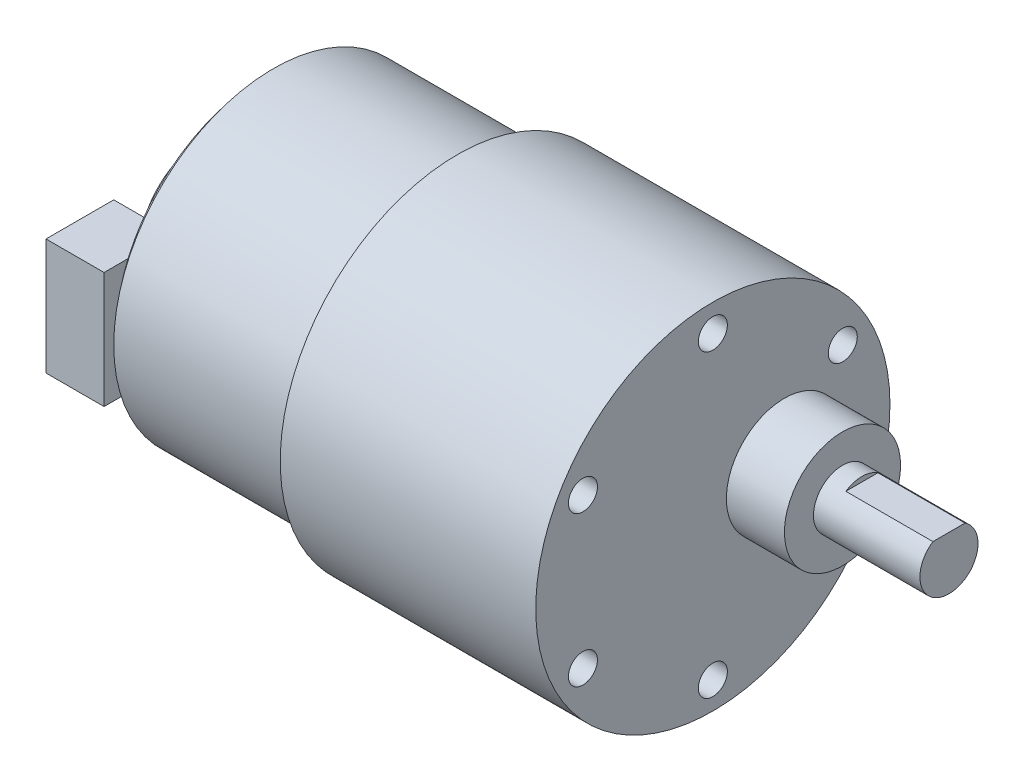
from build123d import *

# Parameters (mm, degrees)
SKETCH_1_R          = 18.3
EXTRUDE_1_DEPTH     = 26.4
SKETCH_4_R          = 16.5
EXTRUDE_2_DEPTH     = 19
SKETCH_5_R          = 15.25
EXTRUDE_3_DEPTH     = 1
SKETCH_6_R          = 6.9
EXTRUDE_4_DEPTH     = 6
SKETCH_7_W          = 7
SKETCH_7_H          = 12
EXTRUDE_5_DEPTH     = 6
SKETCH_3_R          = 1.5
CUT_EXTRUDE_7_DEPTH = 4
SKETCH_18_R         = 6
EXTRUDE_7_DEPTH     = 6
SKETCH_19_R         = 3
EXTRUDE_9_DEPTH     = 2
EXTRUDE_10_DEPTH    = 9


with BuildPart() as part:
    # 草图1 → 凸台-拉伸1 (new body)
    with BuildSketch(Plane(origin=(0, 0, 0), x_dir=(0, 0, -1), z_dir=(1, 0, 0))):
        Circle(SKETCH_1_R)
    extrude(amount=EXTRUDE_1_DEPTH)

    # 草图4 → 凸台-拉伸2 (add)
    with BuildSketch(Plane.ZY):
        Circle(SKETCH_4_R)
    extrude(amount=EXTRUDE_2_DEPTH)

    # 草图5 → 凸台-拉伸3 (add)
    with BuildSketch(Plane.ZY.offset(19)):
        Circle(SKETCH_5_R)
    extrude(amount=EXTRUDE_3_DEPTH)

    # 草图6 → 凸台-拉伸4 (add)
    with BuildSketch(Plane.ZY.offset(20)):
        Circle(SKETCH_6_R)
    extrude(amount=EXTRUDE_4_DEPTH)

    # 草图7 → 凸台-拉伸5 (add)
    with BuildSketch(Plane.ZY.offset(20)):
        with Locations((13, 0)):
            Rectangle(SKETCH_7_W, SKETCH_7_H)
    extrude(amount=EXTRUDE_5_DEPTH)

    # 草图3 → 切除-拉伸7 (cut)
    with BuildSketch(Plane(origin=(26.4, 0, 0), x_dir=(0, 0, -1), z_dir=(1, 0, 0))):
        with Locations((-13.423393759, 7.75)):
            Circle(SKETCH_3_R)
        with Locations((-13.423393759, -7.75)):
            Circle(SKETCH_3_R)
        with Locations((0, -15.5)):
            Circle(SKETCH_3_R)
        with Locations((13.423393759, -7.75)):
            Circle(SKETCH_3_R)
        with Locations((13.423393759, 7.75)):
            Circle(SKETCH_3_R)
        with Locations((0, 15.5)):
            Circle(SKETCH_3_R)
    extrude(amount=-CUT_EXTRUDE_7_DEPTH, mode=Mode.SUBTRACT)

    # 草图18 → 凸台-拉伸7 (add)
    with BuildSketch(Plane(origin=(26.4, 0, 0), x_dir=(0, 0, -1), z_dir=(1, 0, 0))):
        with Locations((7.396149949, 0)):
            Circle(SKETCH_18_R)
    extrude(amount=EXTRUDE_7_DEPTH)

    # 草图19 → 凸台-拉伸9 (add)
    with BuildSketch(Plane(origin=(32.4, 0, 0), x_dir=(0, 0, -1), z_dir=(1, 0, 0))):
        with Locations((7.396149949, 0)):
            Circle(SKETCH_19_R)
    extrude(amount=EXTRUDE_9_DEPTH)

    # 草图23 → 凸台-拉伸10 (add)
    with BuildSketch(Plane(origin=(34.4, 0, 0), x_dir=(0, 0, -1), z_dir=(1, 0, 0))):
        with BuildLine():
            Line((5.737938338, 2.500066849), (9.054361561, 2.500066849))
            ThreePointArc((9.054361561, 2.500066849), (7.396149949, -3), (5.737938338, 2.500066849))
        make_face()
    extrude(amount=EXTRUDE_10_DEPTH)


solid = part.part
